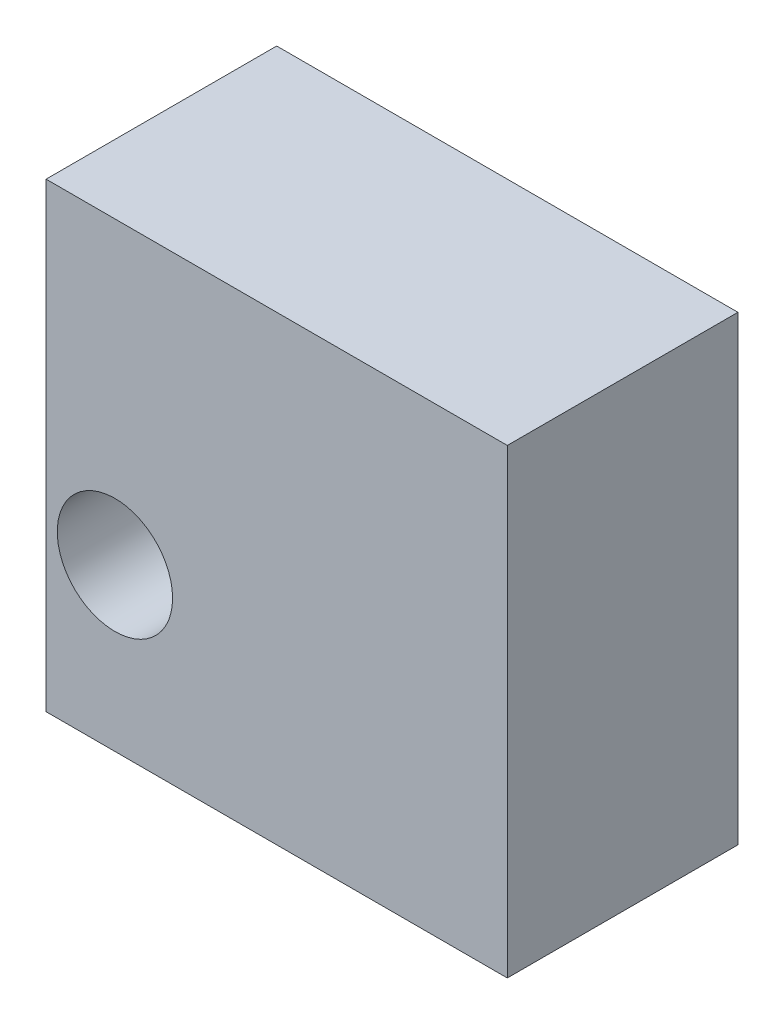
from build123d import *

# Parameters (mm, degrees)
SKETCH_1_W      = 20
SKETCH_1_H      = 20
BASEBOX_DEPTH   = 10
HOLE_WIZARD_1_D = 5


with BuildPart() as part:
    # 草图1 → BaseBox (new body)
    with BuildSketch(Plane.XY):
        with Locations((10, 10)):
            Rectangle(SKETCH_1_W, SKETCH_1_H)
    extrude(amount=BASEBOX_DEPTH)

    # 孔1 (through all)
    with Locations(Plane.XY.offset(10)):
        with Locations((2.98535395, 7.005198385)):
            Hole(HOLE_WIZARD_1_D / 2)


solid = part.part
